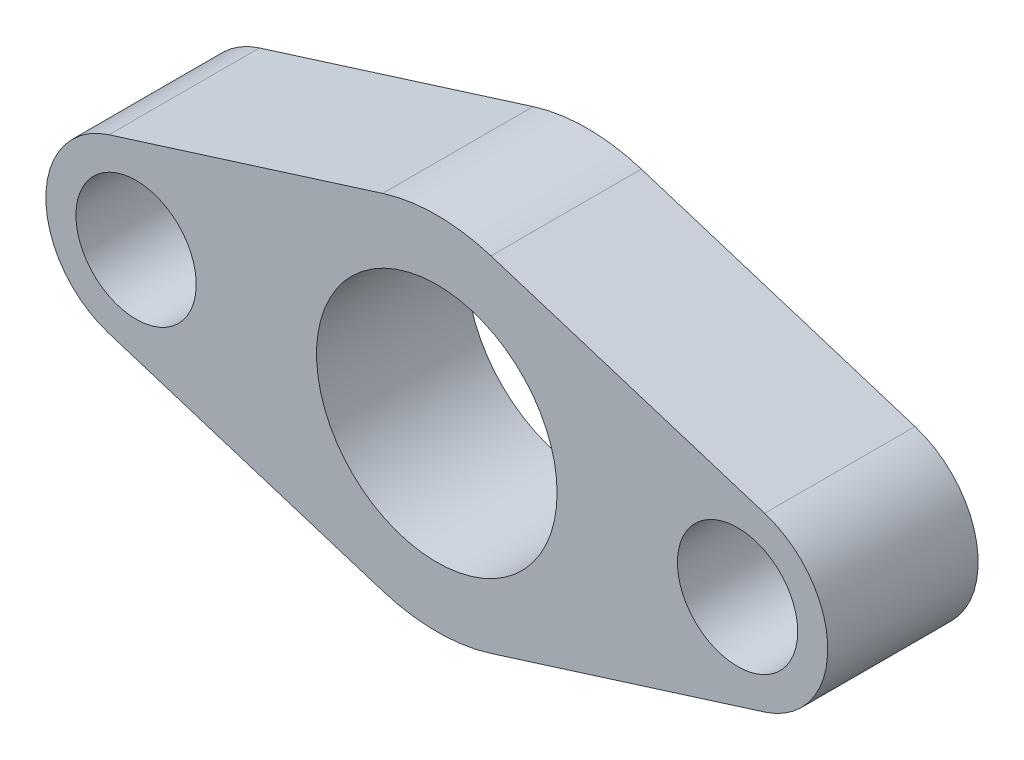
from build123d import *

# Parameters (mm, degrees)
SKETCH1_R           = 20
SKETCH1_R_2         = 10
BOSS_EXTRUDE1_DEPTH = 12.5


with BuildPart() as part:
    # Sketch1 → Boss-Extrude1 (new, symmetric)
    with BuildSketch(Plane.XY):
        with BuildLine():
            Line((134.5, 64.309088021), (89, 78.618176043))
            ThreePointArc((89, 78.618176043), (80, 80), (71, 78.618176043))
            Line((71, 78.618176043), (25.5, 64.309088021))
            ThreePointArc((25.5, 64.309088021), (15, 50), (25.5, 35.690911979))
            Line((25.5, 35.690911979), (71, 21.381823957))
            ThreePointArc((71, 21.381823957), (80, 20), (89, 21.381823957))
            Line((89, 21.381823957), (134.5, 35.690911979))
            ThreePointArc((134.5, 35.690911979), (145, 50), (134.5, 64.309088021))
        make_face()
        with Locations((80, 50)):
            Circle(SKETCH1_R, mode=Mode.SUBTRACT)
        with Locations((130, 50)):
            Circle(SKETCH1_R_2, mode=Mode.SUBTRACT)
        with Locations(Location((30, 50, 0), (0, 0, 180))):
            Circle(SKETCH1_R_2, mode=Mode.SUBTRACT)
    extrude(amount=BOSS_EXTRUDE1_DEPTH, both=True)


solid = part.part
